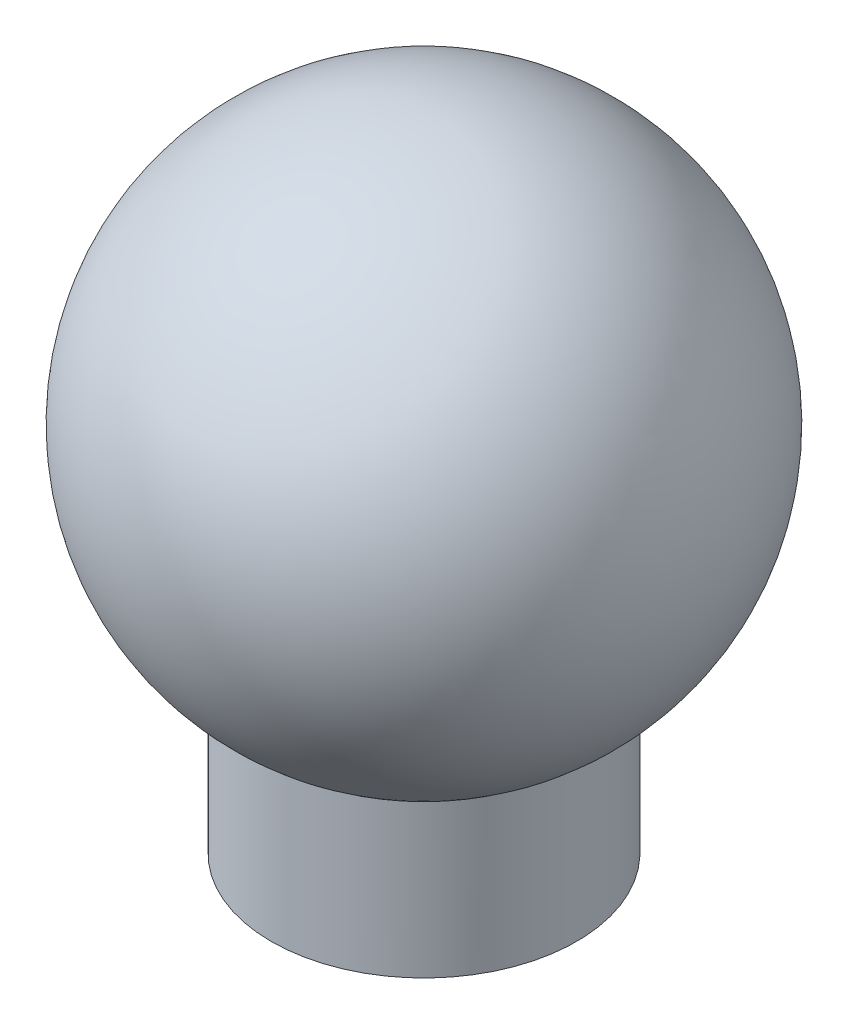
from build123d import *

# Parameters (mm, degrees)
SKETCH1_R           = 25.4
BOSS_EXTRUDE1_DEPTH = 25.4


with BuildPart() as part:
    # Sketch1 → Boss-Extrude1 (new body)
    with BuildSketch(Plane(origin=(0, 0, 0), x_dir=(1, 0, 0), z_dir=(0, 1, 0))):
        with Locations(Location((0, 0, 0), (0, 0, 270))):
            Circle(SKETCH1_R)
    extrude(amount=BOSS_EXTRUDE1_DEPTH)

    # Sketch2 one side → Revolve1 (revolve)
    with BuildSketch(Plane.XY):
        with BuildLine():
            Line((25.4, 25.4), (0, 25.4))
            Line((0, 25.4), (0, 17.427972806))
            ThreePointArc((0, 17.427972806), (13.310834098, 19.467783044), (25.4, 25.4))
        make_face()
        with BuildLine():
            ThreePointArc((44.45, 61.877972806), (31.430896424, 93.308869229), (0, 106.327972806))
            Line((0, 106.327972806), (0, 25.4))
            Line((0, 25.4), (25.4, 25.4))
            ThreePointArc((25.4, 25.4), (39.400713826, 41.301621088), (44.45, 61.877972806))
        make_face()
    revolve(axis=Axis((0, 145.460296173, 0), (0, -1, 0)))


solid = part.part
